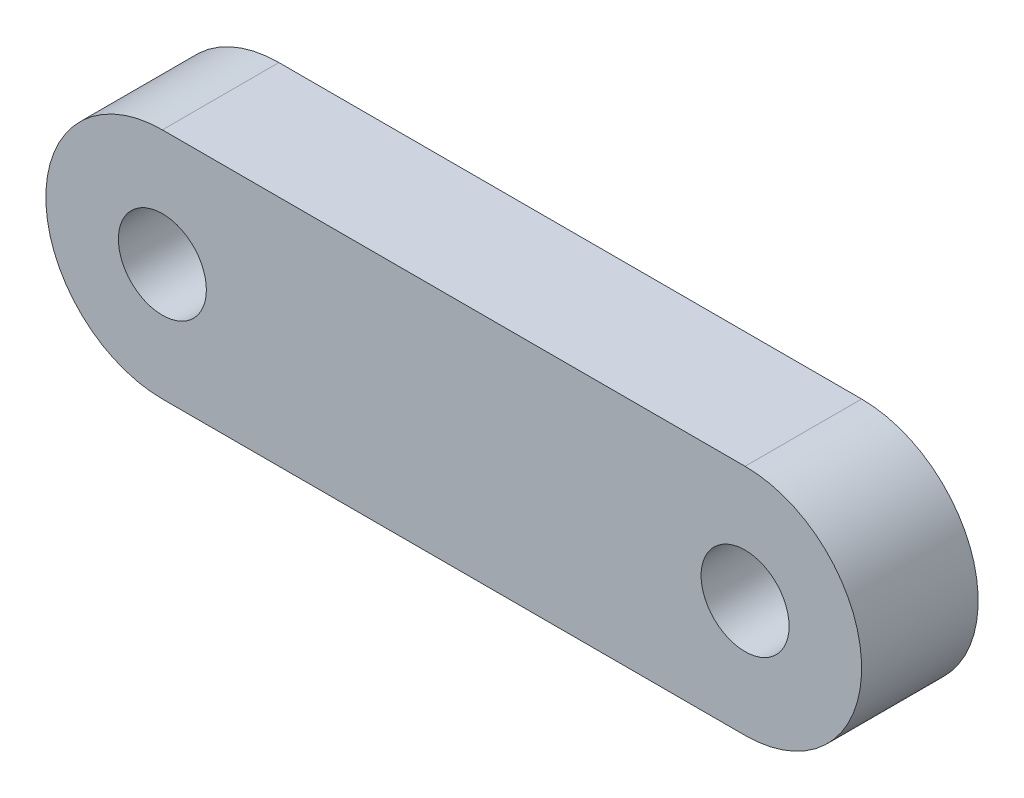
from build123d import *

# Parameters (mm, degrees)
SKETCH1_R           = 1.51
BOSS_EXTRUDE1_DEPTH = 4


with BuildPart() as part:
    # Sketch1 → Boss-Extrude1 (new body)
    with BuildSketch(Plane.XY):
        with BuildLine():
            Line((0, 4), (20, 4))
            ThreePointArc((20, 4), (24, 0), (20, -4))
            Line((20, -4), (0, -4))
            ThreePointArc((0, -4), (-4, 0), (0, 4))
        make_face()
        Circle(SKETCH1_R, mode=Mode.SUBTRACT)
        with Locations((20, 0)):
            Circle(SKETCH1_R, mode=Mode.SUBTRACT)
    extrude(amount=BOSS_EXTRUDE1_DEPTH)


solid = part.part
